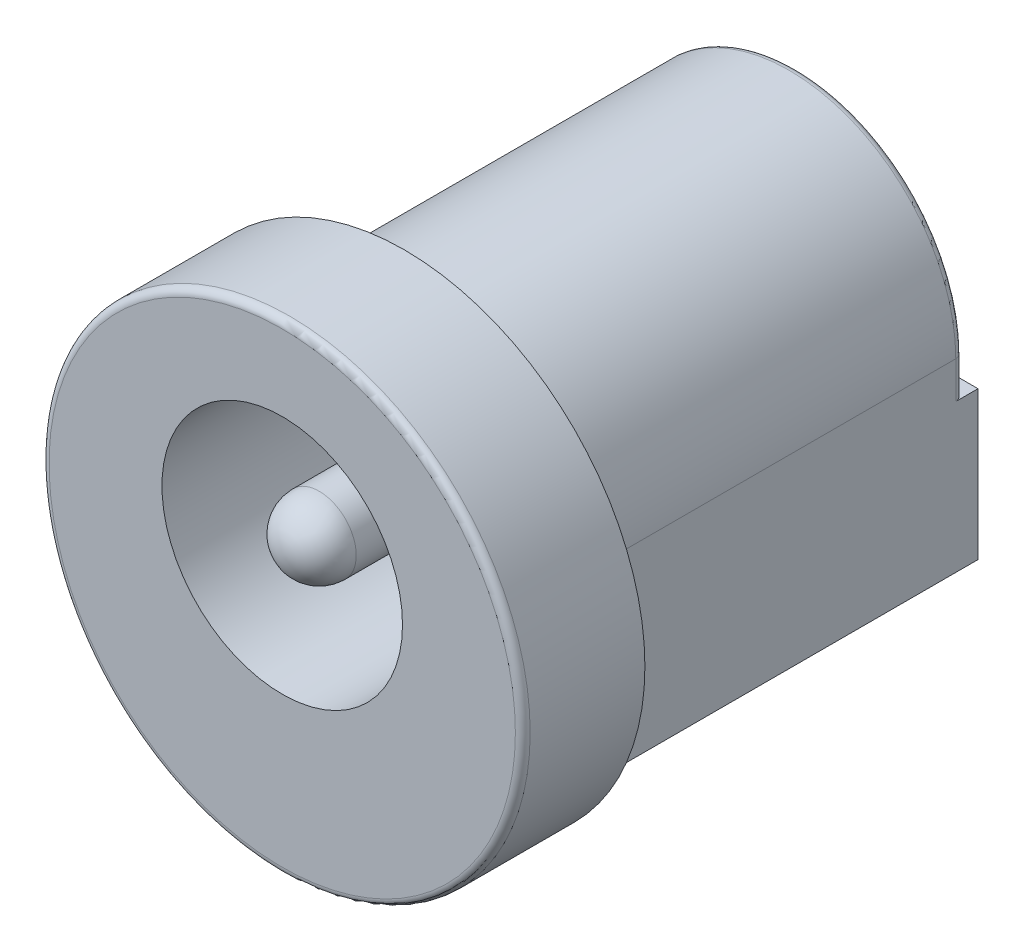
from build123d import *

# Parameters (mm, degrees)
SKETCH1_R           = 6.5
BOSS_EXTRUDE1_DEPTH = 3.3
BOSS_EXTRUDE2_DEPTH = 11
SKETCH3_R           = 3.25
CUT_EXTRUDE1_DEPTH  = 11
SKETCH4_R           = 1
BOSS_EXTRUDE3_DEPTH = 11
FILLET1_R           = 1
CUT_EXTRUDE2_DEPTH  = 0.4
SKETCH6_R           = 0.5
BOSS_EXTRUDE4_DEPTH = 0.4
BOSS_EXTRUDE5_START = -0.4
SKETCH7_R           = 1.9
SKETCH7_R_2         = 0.5
BOSS_EXTRUDE5_DEPTH = 0.4
BOSS_EXTRUDE6_START = -0.4
SKETCH8_R           = 0.5
BOSS_EXTRUDE6_DEPTH = 0.4
SKETCH10_W          = 2.8
SKETCH10_H          = 1
BOSS_EXTRUDE8_DEPTH = 6.4
FILLET4_R           = 0.2
REDONDEO1_R         = 0.2


with BuildPart() as part:
    # Sketch1 → Boss-Extrude1 (new body)
    with BuildSketch(Plane.XY):
        Circle(SKETCH1_R)
    extrude(amount=-BOSS_EXTRUDE1_DEPTH)

    # Sketch2 → Boss-Extrude2 (add)
    with BuildSketch(Plane(origin=(0, 0, -3.3), x_dir=(-1, 0, 0), z_dir=(0, 0, -1))):
        with BuildLine():
            Line((-4.5, -4), (4.5, -4))
            Line((4.5, -4), (4.5, 1))
            ThreePointArc((4.5, 1), (0, 5.5), (-4.5, 1))
            Line((-4.5, 1), (-4.5, -4))
        make_face()
    extrude(amount=BOSS_EXTRUDE2_DEPTH)

    # Sketch3 → Cut-Extrude1 (cut)
    with BuildSketch(Plane.XY):
        with Locations((0, 1)):
            Circle(SKETCH3_R)
    extrude(amount=-CUT_EXTRUDE1_DEPTH, mode=Mode.SUBTRACT)

    # Sketch4 → Boss-Extrude3 (add)
    with BuildSketch(Plane.XY.offset(-11)):
        with Locations((0, 1)):
            Circle(SKETCH4_R)
    extrude(amount=BOSS_EXTRUDE3_DEPTH)

    # Fillet1
    fillet1_edges = [part.edges().sort_by_distance(p)[0] for p in [
        (-1, 1, 0),
    ]]
    fillet(fillet1_edges, radius=FILLET1_R)

    # Sketch5 → Cut-Extrude2 (cut)
    with BuildSketch(Plane(origin=(0, 0, -14.3), x_dir=(-1, 0, 0), z_dir=(0, 0, -1))):
        Polygon((4.5, 0), (1.2, 0), (1.2, -4), (-1.2, -4), (-1.2, 0), (-4.5, 0), (-4.5, 5.5), (4.5, 5.5), align=None)
    extrude(amount=-CUT_EXTRUDE2_DEPTH, mode=Mode.SUBTRACT)

    # Sketch6 → Boss-Extrude4 (add)
    with BuildSketch(Plane(origin=(0, 0, -13.9), x_dir=(-1, 0, 0), z_dir=(0, 0, -1))):
        with BuildLine():
            Line((-1.1, -6.9), (-1.1, 1))
            ThreePointArc((-1.1, 1), (0, 2.1), (1.1, 1))
            Line((1.1, 1), (1.1, -6.9))
            ThreePointArc((1.1, -6.9), (0, -8), (-1.1, -6.9))
        make_face()
        with Locations((0, -6.9)):
            Circle(SKETCH6_R, mode=Mode.SUBTRACT)
        with Locations((0, 1)):
            Circle(SKETCH6_R, mode=Mode.SUBTRACT)
    extrude(amount=BOSS_EXTRUDE4_DEPTH)

    # Sketch7 → Boss-Extrude5 (add)
    with BuildSketch(Plane(origin=(0, 0, -14.3), x_dir=(-1, 0, 0), z_dir=(0, 0, -1)).offset(BOSS_EXTRUDE5_START)):
        with Locations((0, 1)):
            Circle(SKETCH7_R)
        with Locations((0, 1)):
            Circle(SKETCH7_R_2, mode=Mode.SUBTRACT)
    extrude(amount=BOSS_EXTRUDE5_DEPTH)

    # Sketch10 → Boss-Extrude8 (add)
    with BuildSketch(Plane.XY.offset(-11)):
        with Locations((0, -2.25)):
            Rectangle(SKETCH10_W, SKETCH10_H)
    extrude(amount=BOSS_EXTRUDE8_DEPTH)

    # Fillet4
    fillet4_edges = [part.edges().sort_by_distance(p)[0] for p in [
        (0, 5.5, -13.9),
        (-4.5, 0.5, -13.9),
        (4.5, 0.5, -13.9),
    ]]
    fillet(fillet4_edges, radius=FILLET4_R)

    # Redondeo1
    redondeo1_edges = [part.edges().sort_by_distance(p)[0] for p in [
        (-6.5, 0, 0),
    ]]
    fillet(redondeo1_edges, radius=REDONDEO1_R)


with BuildPart() as body_2:
    # Sketch8 → Boss-Extrude6 (new body)
    with BuildSketch(Plane(origin=(0, 0, -8.1), x_dir=(-1, 0, 0), z_dir=(0, 0, -1)).offset(BOSS_EXTRUDE6_START)):
        with BuildLine():
            Line((-1.1, -5.145239298), (-1.1, -6.9))
            ThreePointArc((-1.1, -6.9), (0, -8), (1.1, -6.9))
            Line((1.1, -6.9), (1.1, -5.145239298))
            Line((1.1, -5.145239298), (-1.1, -5.145239298))
        make_face()
        with Locations((0, -6.9)):
            Circle(SKETCH8_R, mode=Mode.SUBTRACT)
    extrude(amount=BOSS_EXTRUDE6_DEPTH)


solid = Compound([part.part, body_2.part])
